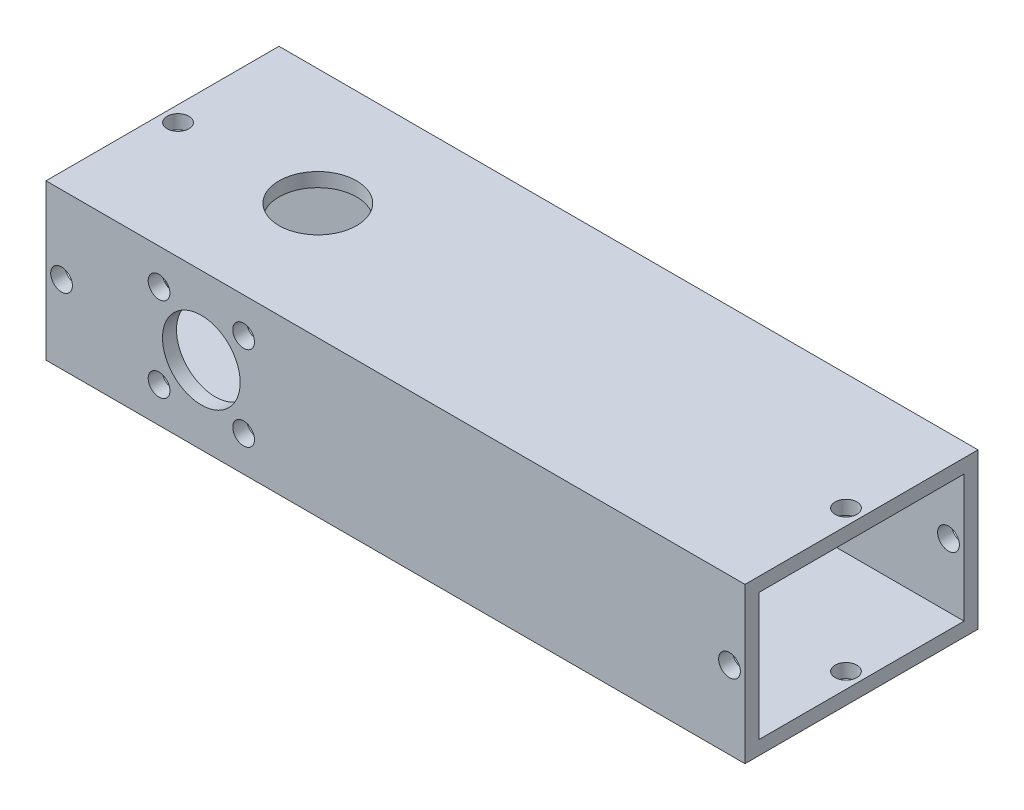
from build123d import *

# Parameters (mm, degrees)
SKETCH1_W           = 114.3
SKETCH1_H           = 38.1
BOSS_EXTRUDE1_DEPTH = 25.4
CUT_EXTRUDE1_REACH  = 125.131
SKETCH2_W           = 33.528
SKETCH2_H           = 20.828
CUT_EXTRUDE2_REACH  = 125.131
SKETCH3_R           = 1.778
CUT_EXTRUDE3_REACH  = 125.131
SKETCH4_R           = 1.778
CUT_EXTRUDE4_REACH  = 125.131
SKETCH5_R           = 1.778
SKETCH5_R_2         = 6.35
CUT_EXTRUDE5_REACH  = 125.131
SKETCH6_R           = 1.778
SKETCH6_R_2         = 6.35
CUT_EXTRUDE6_REACH  = 125.131
SKETCH7_R           = 1.778
SKETCH7_R_2         = 6.35
CUT_EXTRUDE7_REACH  = 125.131
SKETCH8_R           = 1.778
SKETCH8_R_2         = 6.35
CUT_EXTRUDE8_REACH  = 125.131
SKETCH9_R           = 1.778
CUT_EXTRUDE9_REACH  = 125.131
SKETCH10_R          = 1.778


with BuildPart() as part:
    # Sketch1 → Boss-Extrude1 (new body)
    with BuildSketch(Plane(origin=(0, 0, 0), x_dir=(1, 0, 0), z_dir=(0, 1, 0))):
        with Locations((-57.15, -19.05)):
            Rectangle(SKETCH1_W, SKETCH1_H)
    extrude(amount=BOSS_EXTRUDE1_DEPTH)

    # Sketch2 → Cut-Extrude1 (cut, up to next)
    with BuildSketch(Plane(origin=(0, 0, 0), x_dir=(0, 0, -1), z_dir=(1, 0, 0)), mode=Mode.PRIVATE) as cut_extrude1_sk1:
        with Locations((-19.05, 12.7)):
            Rectangle(SKETCH2_W, SKETCH2_H)
    cut_extrude1_tool1 = extrude(cut_extrude1_sk1.sketch, amount=-CUT_EXTRUDE1_REACH, mode=Mode.PRIVATE) & part.part
    add(cut_extrude1_tool1.solids().sort_by_distance((0, 12.7, 19.05))[0], mode=Mode.SUBTRACT)

    # Sketch3 → Cut-Extrude2 (cut, up to next)
    with BuildSketch(Plane.XY.offset(38.1), mode=Mode.PRIVATE) as cut_extrude2_sk1:
        with Locations((-2.54, 12.7)):
            Circle(SKETCH3_R)
    cut_extrude2_tool1 = extrude(cut_extrude2_sk1.sketch, amount=-CUT_EXTRUDE2_REACH, mode=Mode.PRIVATE) & part.part
    add(cut_extrude2_tool1.solids().sort_by_distance((-2.54, 12.7, 38.1))[0], mode=Mode.SUBTRACT)

    # Sketch4 → Cut-Extrude3 (cut, up to next)
    with BuildSketch(Plane(origin=(0, 0, 0), x_dir=(-1, 0, 0), z_dir=(0, 0, -1)), mode=Mode.PRIVATE) as cut_extrude3_sk1:
        with Locations(Location((2.54, 12.7, 0), (0, 0, 180))):
            Circle(SKETCH4_R)
    cut_extrude3_tool1 = extrude(cut_extrude3_sk1.sketch, amount=-CUT_EXTRUDE3_REACH, mode=Mode.PRIVATE) & part.part
    add(cut_extrude3_tool1.solids().sort_by_distance((-2.54, 12.7, 0))[0], mode=Mode.SUBTRACT)

    # Sketch5 → Cut-Extrude4 (cut, up to next)
    with BuildSketch(Plane.XY.offset(38.1), mode=Mode.PRIVATE) as cut_extrude4_sk1:
        with Locations((-111.76, 12.7)):
            Circle(SKETCH5_R)
    cut_extrude4_tool1 = extrude(cut_extrude4_sk1.sketch, amount=-CUT_EXTRUDE4_REACH, mode=Mode.PRIVATE) & part.part
    # Sketch5 → Cut-Extrude4 (cut, up to next)
    with BuildSketch(Plane.XY.offset(38.1), mode=Mode.PRIVATE) as cut_extrude4_sk2:
        with Locations((-88.9, 12.7)):
            Circle(SKETCH5_R_2)
    cut_extrude4_tool2 = extrude(cut_extrude4_sk2.sketch, amount=-CUT_EXTRUDE4_REACH, mode=Mode.PRIVATE) & part.part
    # Sketch5 → Cut-Extrude4 (cut, up to next)
    with BuildSketch(Plane.XY.offset(38.1), mode=Mode.PRIVATE) as cut_extrude4_sk3:
        with Locations((-95.814797213, 19.614797213)):
            Circle(SKETCH5_R)
    cut_extrude4_tool3 = extrude(cut_extrude4_sk3.sketch, amount=-CUT_EXTRUDE4_REACH, mode=Mode.PRIVATE) & part.part
    # Sketch5 → Cut-Extrude4 (cut, up to next)
    with BuildSketch(Plane.XY.offset(38.1), mode=Mode.PRIVATE) as cut_extrude4_sk4:
        with Locations((-81.985202787, 19.614797213)):
            Circle(SKETCH5_R)
    cut_extrude4_tool4 = extrude(cut_extrude4_sk4.sketch, amount=-CUT_EXTRUDE4_REACH, mode=Mode.PRIVATE) & part.part
    # Sketch5 → Cut-Extrude4 (cut, up to next)
    with BuildSketch(Plane.XY.offset(38.1), mode=Mode.PRIVATE) as cut_extrude4_sk5:
        with Locations((-95.814797213, 5.785202787)):
            Circle(SKETCH5_R)
    cut_extrude4_tool5 = extrude(cut_extrude4_sk5.sketch, amount=-CUT_EXTRUDE4_REACH, mode=Mode.PRIVATE) & part.part
    # Sketch5 → Cut-Extrude4 (cut, up to next)
    with BuildSketch(Plane.XY.offset(38.1), mode=Mode.PRIVATE) as cut_extrude4_sk6:
        with Locations((-81.985202787, 5.785202787)):
            Circle(SKETCH5_R)
    cut_extrude4_tool6 = extrude(cut_extrude4_sk6.sketch, amount=-CUT_EXTRUDE4_REACH, mode=Mode.PRIVATE) & part.part
    add(cut_extrude4_tool1.solids().sort_by_distance((-111.76, 12.7, 38.1))[0], mode=Mode.SUBTRACT)
    add(cut_extrude4_tool2.solids().sort_by_distance((-88.9, 12.7, 38.1))[0], mode=Mode.SUBTRACT)
    add(cut_extrude4_tool3.solids().sort_by_distance((-95.814797, 19.614797, 38.1))[0], mode=Mode.SUBTRACT)
    add(cut_extrude4_tool4.solids().sort_by_distance((-81.985203, 19.614797, 38.1))[0], mode=Mode.SUBTRACT)
    add(cut_extrude4_tool5.solids().sort_by_distance((-95.814797, 5.785203, 38.1))[0], mode=Mode.SUBTRACT)
    add(cut_extrude4_tool6.solids().sort_by_distance((-81.985203, 5.785203, 38.1))[0], mode=Mode.SUBTRACT)

    # Sketch6 → Cut-Extrude5 (cut, up to next)
    with BuildSketch(Plane(origin=(0, 0, 0), x_dir=(-1, 0, 0), z_dir=(0, 0, -1)), mode=Mode.PRIVATE) as cut_extrude5_sk1:
        with Locations(Location((111.76, 12.7, 0), (0, 0, 180))):
            Circle(SKETCH6_R)
    cut_extrude5_tool1 = extrude(cut_extrude5_sk1.sketch, amount=-CUT_EXTRUDE5_REACH, mode=Mode.PRIVATE) & part.part
    # Sketch6 → Cut-Extrude5 (cut, up to next)
    with BuildSketch(Plane(origin=(0, 0, 0), x_dir=(-1, 0, 0), z_dir=(0, 0, -1)), mode=Mode.PRIVATE) as cut_extrude5_sk2:
        with Locations(Location((88.9, 12.7, 0), (0, 0, 180))):
            Circle(SKETCH6_R_2)
    cut_extrude5_tool2 = extrude(cut_extrude5_sk2.sketch, amount=-CUT_EXTRUDE5_REACH, mode=Mode.PRIVATE) & part.part
    # Sketch6 → Cut-Extrude5 (cut, up to next)
    with BuildSketch(Plane(origin=(0, 0, 0), x_dir=(-1, 0, 0), z_dir=(0, 0, -1)), mode=Mode.PRIVATE) as cut_extrude5_sk3:
        with Locations(Location((81.985202787, 19.614797213, 0), (0, 0, 180))):
            Circle(SKETCH6_R)
    cut_extrude5_tool3 = extrude(cut_extrude5_sk3.sketch, amount=-CUT_EXTRUDE5_REACH, mode=Mode.PRIVATE) & part.part
    # Sketch6 → Cut-Extrude5 (cut, up to next)
    with BuildSketch(Plane(origin=(0, 0, 0), x_dir=(-1, 0, 0), z_dir=(0, 0, -1)), mode=Mode.PRIVATE) as cut_extrude5_sk4:
        with Locations(Location((95.814797213, 19.614797213, 0), (0, 0, 180))):
            Circle(SKETCH6_R)
    cut_extrude5_tool4 = extrude(cut_extrude5_sk4.sketch, amount=-CUT_EXTRUDE5_REACH, mode=Mode.PRIVATE) & part.part
    # Sketch6 → Cut-Extrude5 (cut, up to next)
    with BuildSketch(Plane(origin=(0, 0, 0), x_dir=(-1, 0, 0), z_dir=(0, 0, -1)), mode=Mode.PRIVATE) as cut_extrude5_sk5:
        with Locations(Location((95.814797213, 5.785202787, 0), (0, 0, 180))):
            Circle(SKETCH6_R)
    cut_extrude5_tool5 = extrude(cut_extrude5_sk5.sketch, amount=-CUT_EXTRUDE5_REACH, mode=Mode.PRIVATE) & part.part
    # Sketch6 → Cut-Extrude5 (cut, up to next)
    with BuildSketch(Plane(origin=(0, 0, 0), x_dir=(-1, 0, 0), z_dir=(0, 0, -1)), mode=Mode.PRIVATE) as cut_extrude5_sk6:
        with Locations(Location((81.985202787, 5.785202787, 0), (0, 0, 180))):
            Circle(SKETCH6_R)
    cut_extrude5_tool6 = extrude(cut_extrude5_sk6.sketch, amount=-CUT_EXTRUDE5_REACH, mode=Mode.PRIVATE) & part.part
    add(cut_extrude5_tool1.solids().sort_by_distance((-111.76, 12.7, 0))[0], mode=Mode.SUBTRACT)
    add(cut_extrude5_tool2.solids().sort_by_distance((-88.9, 12.7, 0))[0], mode=Mode.SUBTRACT)
    add(cut_extrude5_tool3.solids().sort_by_distance((-81.985203, 19.614797, 0))[0], mode=Mode.SUBTRACT)
    add(cut_extrude5_tool4.solids().sort_by_distance((-95.814797, 19.614797, 0))[0], mode=Mode.SUBTRACT)
    add(cut_extrude5_tool5.solids().sort_by_distance((-95.814797, 5.785203, 0))[0], mode=Mode.SUBTRACT)
    add(cut_extrude5_tool6.solids().sort_by_distance((-81.985203, 5.785203, 0))[0], mode=Mode.SUBTRACT)

    # Sketch7 → Cut-Extrude6 (cut, up to next)
    with BuildSketch(Plane(origin=(0, 25.4, 0), x_dir=(1, 0, 0), z_dir=(0, 1, 0)), mode=Mode.PRIVATE) as cut_extrude6_sk1:
        with Locations(Location((-111.76, -19.05, 0), (0, 0, 270))):
            Circle(SKETCH7_R)
    cut_extrude6_tool1 = extrude(cut_extrude6_sk1.sketch, amount=-CUT_EXTRUDE6_REACH, mode=Mode.PRIVATE) & part.part
    # Sketch7 → Cut-Extrude6 (cut, up to next)
    with BuildSketch(Plane(origin=(0, 25.4, 0), x_dir=(1, 0, 0), z_dir=(0, 1, 0)), mode=Mode.PRIVATE) as cut_extrude6_sk2:
        with Locations(Location((-88.9, -19.05, 0), (0, 0, 270))):
            Circle(SKETCH7_R_2)
    cut_extrude6_tool2 = extrude(cut_extrude6_sk2.sketch, amount=-CUT_EXTRUDE6_REACH, mode=Mode.PRIVATE) & part.part
    add(cut_extrude6_tool1.solids().sort_by_distance((-111.76, 25.4, 19.05))[0], mode=Mode.SUBTRACT)
    add(cut_extrude6_tool2.solids().sort_by_distance((-88.9, 25.4, 19.05))[0], mode=Mode.SUBTRACT)

    # Sketch8 → Cut-Extrude7 (cut, up to next)
    with BuildSketch(Plane.XZ, mode=Mode.PRIVATE) as cut_extrude7_sk1:
        with Locations(Location((-111.76, 19.05, 0), (0, 0, 90))):
            Circle(SKETCH8_R)
    cut_extrude7_tool1 = extrude(cut_extrude7_sk1.sketch, amount=-CUT_EXTRUDE7_REACH, mode=Mode.PRIVATE) & part.part
    # Sketch8 → Cut-Extrude7 (cut, up to next)
    with BuildSketch(Plane.XZ, mode=Mode.PRIVATE) as cut_extrude7_sk2:
        with Locations(Location((-88.9, 19.05, 0), (0, 0, 90))):
            Circle(SKETCH8_R_2)
    cut_extrude7_tool2 = extrude(cut_extrude7_sk2.sketch, amount=-CUT_EXTRUDE7_REACH, mode=Mode.PRIVATE) & part.part
    add(cut_extrude7_tool1.solids().sort_by_distance((-111.76, 0, 19.05))[0], mode=Mode.SUBTRACT)
    add(cut_extrude7_tool2.solids().sort_by_distance((-88.9, 0, 19.05))[0], mode=Mode.SUBTRACT)

    # Sketch9 → Cut-Extrude8 (cut, up to next)
    with BuildSketch(Plane(origin=(0, 25.4, 0), x_dir=(1, 0, 0), z_dir=(0, 1, 0)), mode=Mode.PRIVATE) as cut_extrude8_sk1:
        with Locations(Location((-2.54, -19.05, 0), (0, 0, 270))):
            Circle(SKETCH9_R)
    cut_extrude8_tool1 = extrude(cut_extrude8_sk1.sketch, amount=-CUT_EXTRUDE8_REACH, mode=Mode.PRIVATE) & part.part
    add(cut_extrude8_tool1.solids().sort_by_distance((-2.54, 25.4, 19.05))[0], mode=Mode.SUBTRACT)

    # Sketch10 → Cut-Extrude9 (cut, up to next)
    with BuildSketch(Plane(origin=(0, 0, 0), x_dir=(-1, 0, 0), z_dir=(0, -1, 0)), mode=Mode.PRIVATE) as cut_extrude9_sk1:
        with Locations(Location((2.54, -19.05, 0), (0, 0, 270))):
            Circle(SKETCH10_R)
    cut_extrude9_tool1 = extrude(cut_extrude9_sk1.sketch, amount=-CUT_EXTRUDE9_REACH, mode=Mode.PRIVATE) & part.part
    add(cut_extrude9_tool1.solids().sort_by_distance((-2.54, 0, 19.05))[0], mode=Mode.SUBTRACT)


solid = part.part
